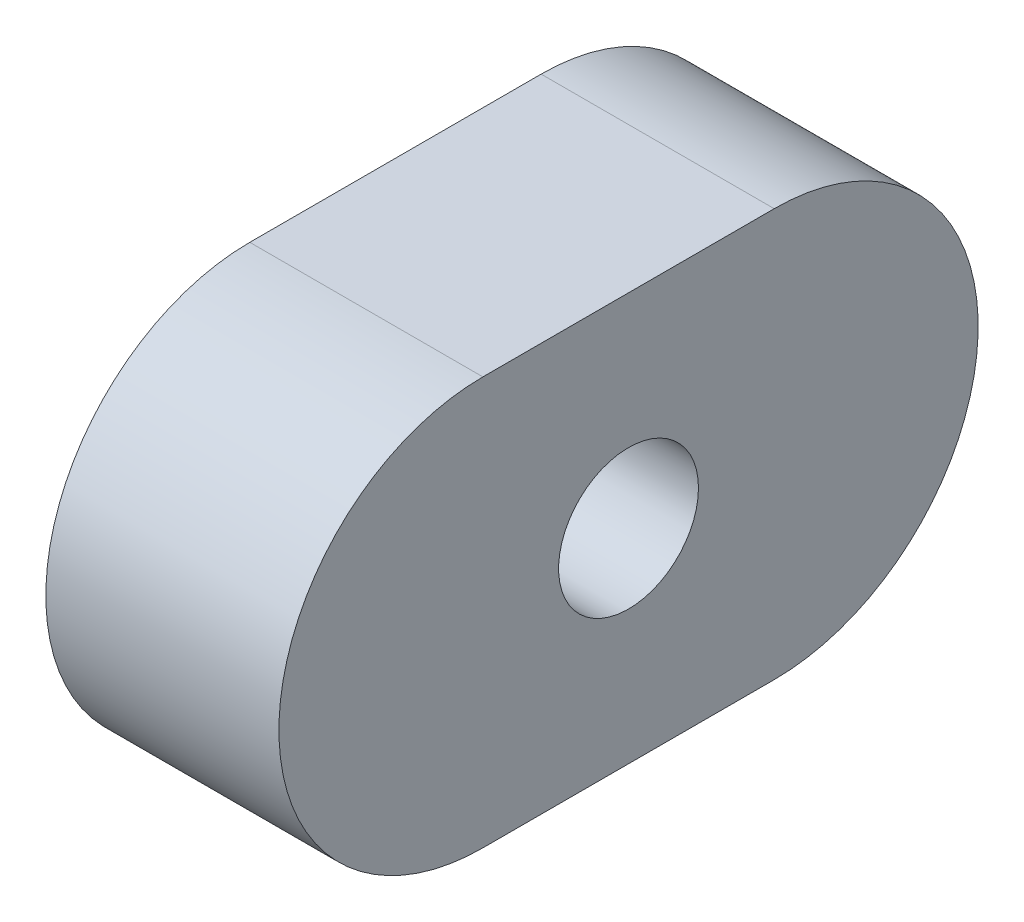
from build123d import *

# Parameters (mm, degrees)
SKETCH1_R           = 6
BOSS_EXTRUDE1_DEPTH = 10


with BuildPart() as part:
    # Sketch1 → Boss-Extrude1 (new, symmetric)
    with BuildSketch(Plane(origin=(0, 0, 0), x_dir=(0, 0, -1), z_dir=(1, 0, 0))):
        with BuildLine():
            Line((12.5, -17.5), (-12.5, -17.5))
            ThreePointArc((-12.5, -17.5), (-30, 0), (-12.5, 17.5))
            Line((-12.5, 17.5), (12.5, 17.5))
            ThreePointArc((12.5, 17.5), (30, 0), (12.5, -17.5))
        make_face()
        Circle(SKETCH1_R, mode=Mode.SUBTRACT)
    extrude(amount=BOSS_EXTRUDE1_DEPTH, both=True)


solid = part.part
